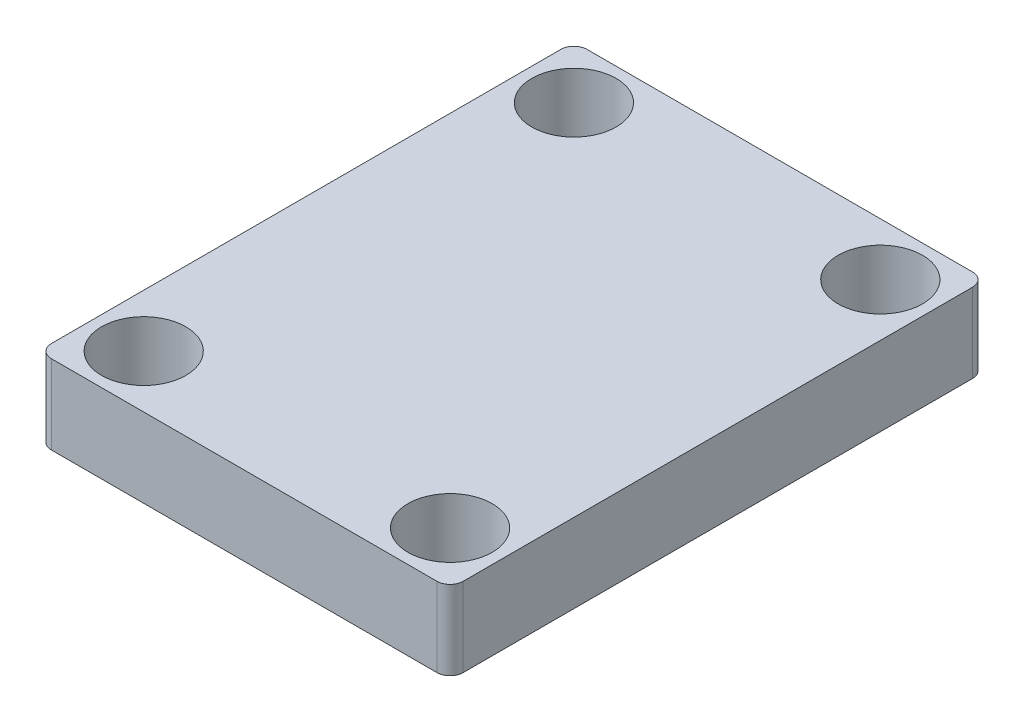
from build123d import *

# Parameters (mm, degrees)
SKETCH_1_W      = 15.621
SKETCH_1_H      = 20.32
SKETCH_1_R      = 1.6
EXTRUDE_1_DEPTH = 3
FILLET_1_R      = 0.5


with BuildPart() as part:
    # 草图1 → 凸台-拉伸1 (new body)
    with BuildSketch(Plane(origin=(0, 0, 0), x_dir=(1, 0, 0), z_dir=(0, 1, 0))):
        Rectangle(SKETCH_1_W, SKETCH_1_H)
        with Locations(Location((5.8105, -8.16, 0), (0, 0, 270))):
            Circle(SKETCH_1_R, mode=Mode.SUBTRACT)
        with Locations(Location((-5.8105, -8.16, 0), (0, 0, 90))):
            Circle(SKETCH_1_R, mode=Mode.SUBTRACT)
        with Locations(Location((5.8105, 8.16, 0), (0, 0, 90))):
            Circle(SKETCH_1_R, mode=Mode.SUBTRACT)
        with Locations(Location((-5.8105, 8.16, 0), (0, 0, 270))):
            Circle(SKETCH_1_R, mode=Mode.SUBTRACT)
    extrude(amount=EXTRUDE_1_DEPTH)

    # 圆角1
    fillet_1_edges = [part.edges().sort_by_distance(p)[0] for p in [
        (7.8105, 1.5, 10.16),
        (-7.8105, 1.5, 10.16),
        (-7.8105, 1.5, -10.16),
        (7.8105, 1.5, -10.16),
    ]]
    fillet(fillet_1_edges, radius=FILLET_1_R)


solid = part.part
